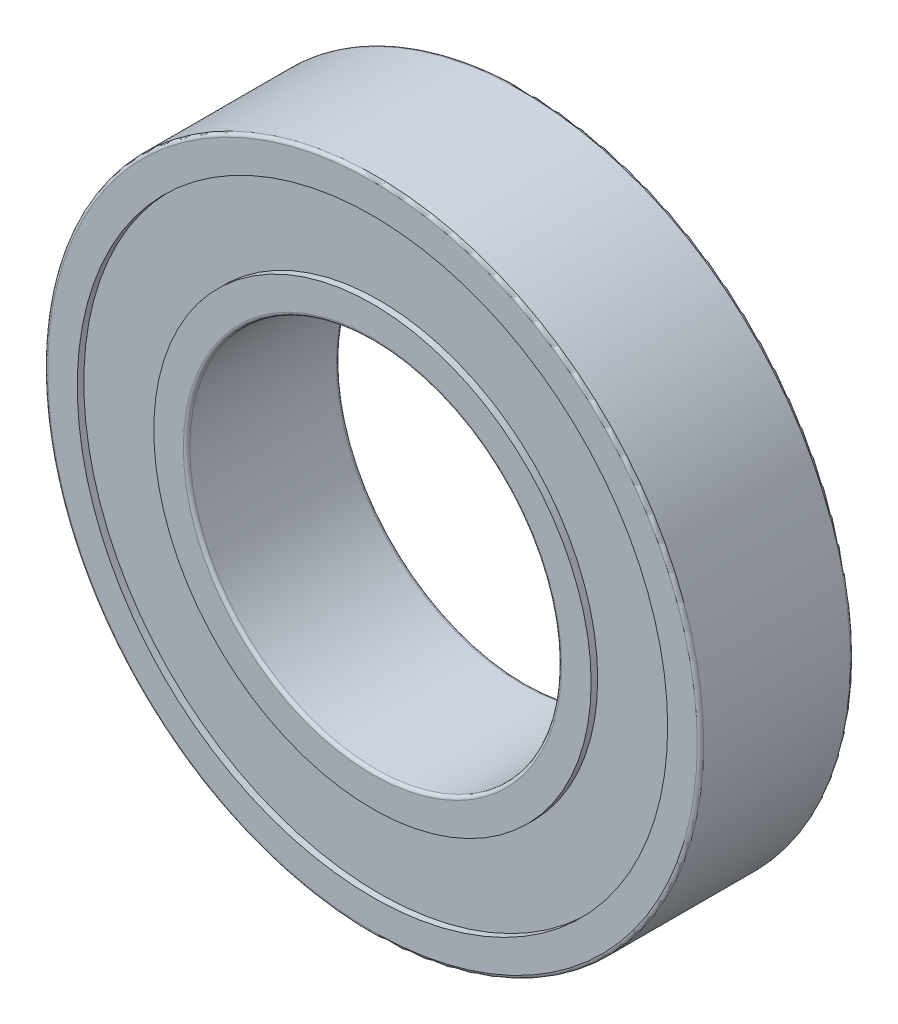
from build123d import *

# Parameters (mm, degrees)
SKETCH1_R           = 15
SKETCH1_R_2         = 8.5
BOSS_EXTRUDE1_DEPTH = 7
SKETCH2_R           = 13.5
SKETCH2_R_2         = 10
CUT_EXTRUDE1_DEPTH  = 0.3
CUT_EXTRUDE2_START  = -6.5
SKETCH2_2_R         = 13.5
SKETCH2_2_R_2       = 10
CUT_EXTRUDE2_DEPTH  = 0.5
FILLET1_R           = 0.15


with BuildPart() as part:
    # Sketch1 → Boss-Extrude1 (new body)
    with BuildSketch(Plane.XY):
        Circle(SKETCH1_R)
        Circle(SKETCH1_R_2, mode=Mode.SUBTRACT)
    extrude(amount=BOSS_EXTRUDE1_DEPTH)

    # Sketch2 → Cut-Extrude1 (cut)
    with BuildSketch(Plane.XY.offset(7)):
        Circle(SKETCH2_R)
        Circle(SKETCH2_R_2, mode=Mode.SUBTRACT)
    extrude(amount=-CUT_EXTRUDE1_DEPTH, mode=Mode.SUBTRACT)

    # Sketch2<2> → Cut-Extrude2 (cut)
    with BuildSketch(Plane.XY.offset(7).offset(CUT_EXTRUDE2_START)):
        Circle(SKETCH2_2_R)
        Circle(SKETCH2_2_R_2, mode=Mode.SUBTRACT)
    extrude(amount=-CUT_EXTRUDE2_DEPTH, mode=Mode.SUBTRACT)

    # Fillet1
    fillet1_edges = [part.edges().sort_by_distance(p)[0] for p in [
        (-15, 0, 0),
        (-15, 0, 7),
        (-8.5, 0, 0),
        (-8.5, 0, 7),
    ]]
    fillet(fillet1_edges, radius=FILLET1_R)


solid = part.part
